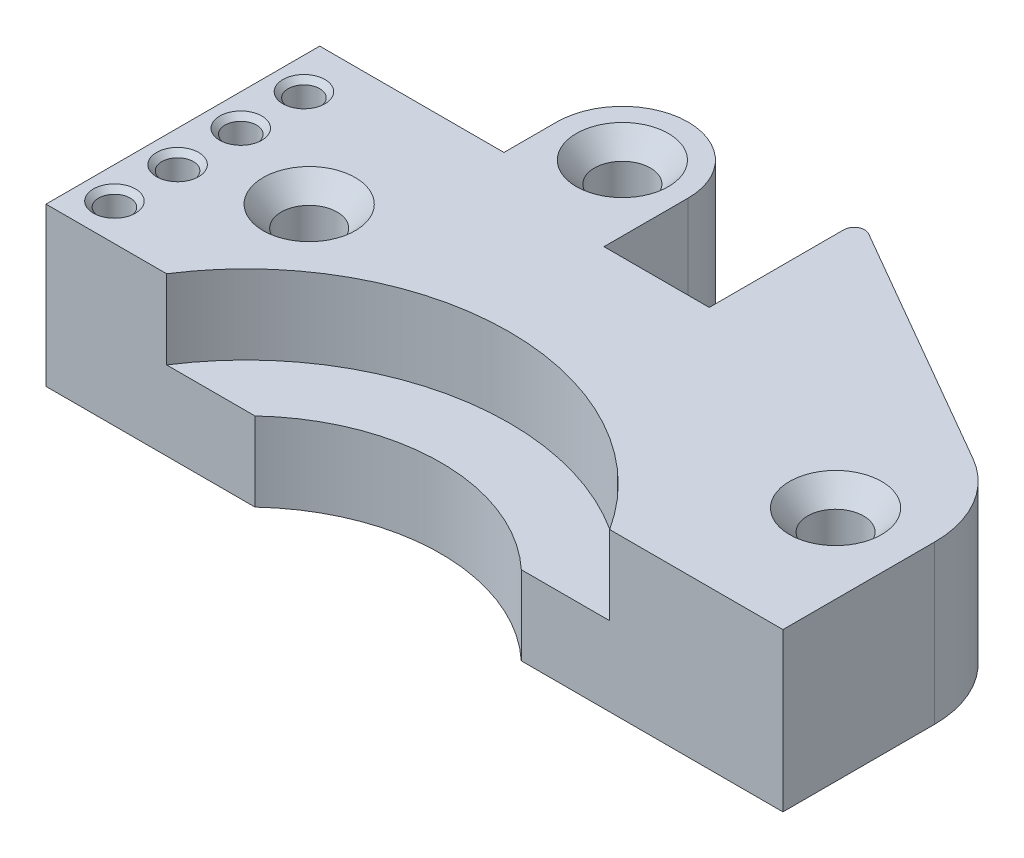
from build123d import *

# Parameters (mm, degrees)
BOSS_EXTRUDE1_DEPTH                              = 19.05
F_1_4_20_TAPPED_HOLE1_D                          = 5.1054
F_1_4_20_TAPPED_HOLE1_DEPTH                      = 19.05
F_1_4_20_TAPPED_HOLE1_TIP                        = 1.533816902
SKETCH4_R                                        = 63.5
CUT_EXTRUDE1_DEPTH                               = 19.05
CSK_FOR_1_2_FLAT_HEAD_MACHINE_SCREW1_D           = 13.49248
CSK_FOR_1_2_FLAT_HEAD_MACHINE_SCREW1_CSINK_D     = 22.225
CSK_FOR_1_2_FLAT_HEAD_MACHINE_SCREW1_CSINK_ANGLE = 82
FILLET1_R                                        = 2.54
LPATTERN1_COUNT                                  = 4
LPATTERN1_PITCH                                  = 15.24


with BuildPart() as part:
    # Sketch1 → Boss-Extrude1 (new, symmetric)
    with BuildSketch(Plane(origin=(0, 0, 0), x_dir=(1, 0, 0), z_dir=(0, 1, 0))):
        with BuildLine():
            Line((0, 0), (50.421258973, 0))
            ThreePointArc((50.421258973, 0), (82.55, 12.7), (114.678741027, 0))
            Line((114.678741027, 0), (177.8, 0))
            Line((177.8, 0), (177.8, 36.59121265))
            ThreePointArc((177.8, 36.59121265), (174.397045256, 49.29121265), (165.1, 58.588257906))
            Line((165.1, 58.588257906), (101.6, 95.25))
            Line((101.6, 95.25), (101.6, 58.42))
            Line((101.6, 58.42), (76.2, 58.42))
            Line((76.2, 58.42), (76.2, 78.74))
            ThreePointArc((76.2, 78.74), (60.325, 94.615), (44.45, 78.74))
            Line((44.45, 78.74), (44.45, 66.04))
            Line((44.45, 66.04), (0, 66.04))
            Line((0, 66.04), (0, 0))
        make_face()
    extrude(amount=BOSS_EXTRUDE1_DEPTH, both=True)

    # 1/4-20 Tapped Hole1
    with Locations(Plane(origin=(66.644459855, 0, -115.431590512), x_dir=(-0.86602540378444, 0, -0.49999999999999784), z_dir=(0.49999999999999784, 0, -0.86602540378444))):
        with Locations((-66.04, 0)):
            Hole(F_1_4_20_TAPPED_HOLE1_D / 2, depth=F_1_4_20_TAPPED_HOLE1_DEPTH)
            with Locations((0, 0, -(F_1_4_20_TAPPED_HOLE1_DEPTH + F_1_4_20_TAPPED_HOLE1_TIP / 2))):  # 118° drill point
                Cone(0, F_1_4_20_TAPPED_HOLE1_D / 2, F_1_4_20_TAPPED_HOLE1_TIP, mode=Mode.SUBTRACT)

    # Sketch4 → Cut-Extrude1 (cut)
    with BuildSketch(Plane(origin=(0, 19.05, 0), x_dir=(1, 0, 0), z_dir=(0, 1, 0))):
        with Locations((82.55, -34.29)):
            Circle(SKETCH4_R)
    extrude(amount=-CUT_EXTRUDE1_DEPTH, mode=Mode.SUBTRACT)

    # CSK for 1/2 Flat Head Machine Screw1 (through all)
    with Locations(Plane(origin=(0, 19.05, 0), x_dir=(1, 0, 0), z_dir=(0, 1, 0))):
        with Locations((60.325, 78.74), (31.75, 31.75), (158.75, 31.75)):
            CounterSinkHole(CSK_FOR_1_2_FLAT_HEAD_MACHINE_SCREW1_D / 2, CSK_FOR_1_2_FLAT_HEAD_MACHINE_SCREW1_CSINK_D / 2, counter_sink_angle=CSK_FOR_1_2_FLAT_HEAD_MACHINE_SCREW1_CSINK_ANGLE)

    # Fillet1
    fillet1_edges = [part.edges().sort_by_distance(p)[0] for p in [
        (101.6, 0, -95.25),
    ]]
    fillet(fillet1_edges, radius=FILLET1_R)

    # Sketch8 → Cut-Revolve1 (revolve, cut)
    with BuildSketch(Plane(origin=(7.62, 0, 0), x_dir=(0, 0, -1), z_dir=(1, 0, 0)), mode=Mode.PRIVATE) as cut_revolve1_sk:
        Polygon((3.81, 19.05), (5.08, 17.78), (5.08, 10.16), (6.604, 9.28011819), (6.604, 2.643567375), (8.89, 1.27), (8.89, 19.05), align=None)
    cut_revolve1 = revolve(cut_revolve1_sk.sketch.rotate(Axis((7.62, 1.27, -8.89), (0, 1, 0)), 180), axis=Axis((7.62, 1.27, -8.89), (0, 1, 0)), mode=Mode.SUBTRACT)

    # LPattern1: Cut-Revolve1 ×4
    with Locations(*[(0, 0, -i * LPATTERN1_PITCH) for i in range(1, LPATTERN1_COUNT)]):
        add(cut_revolve1, mode=Mode.SUBTRACT)

    # Sketch9 → 1/16 NPT Tapped Hole1 (revolve, cut)
    with BuildSketch(Plane(origin=(7.62, 2.54, -66.04), x_dir=(0, 1, 0), z_dir=(1, 0, 0))):
        Polygon((0, 0), (0, 63.568685027), (3.0734, 61.722), (3.0734, 6.858), (3.776858756, 6.858), (3.9679118, 0.4770882), (4.445, 0), align=None)
    revolve(axis=Axis((7.62, 2.54, -72.39), (0, 0, 1)), mode=Mode.SUBTRACT)


solid = part.part
